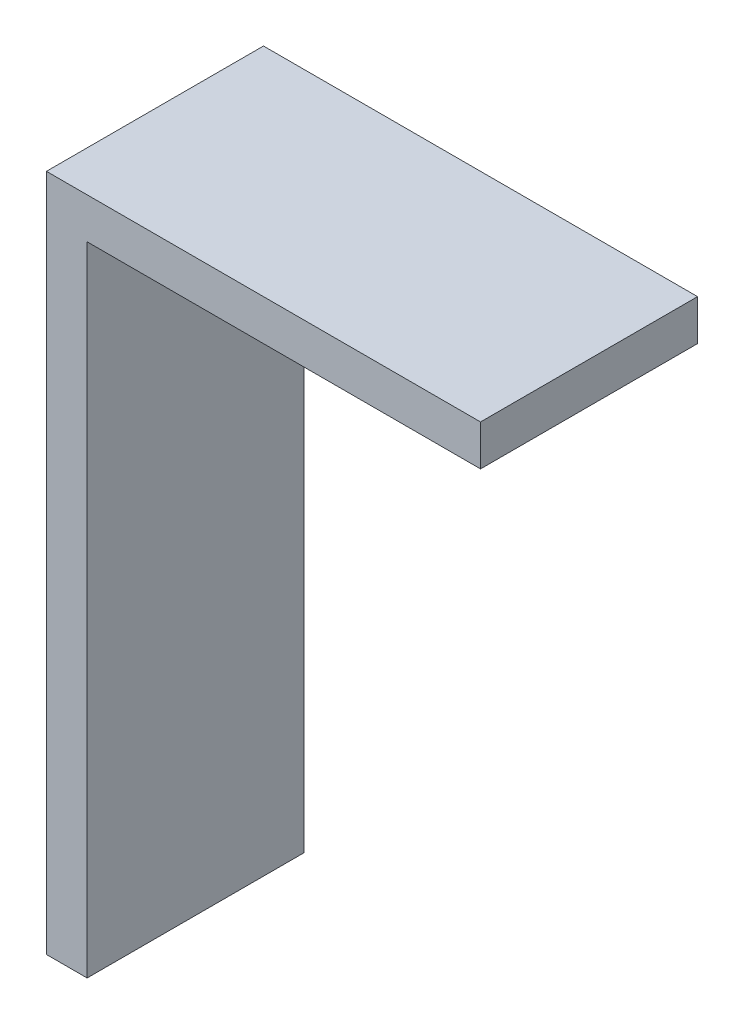
from build123d import *

# Parameters (mm, degrees)
SALIENTE_EXTRUIR1_DEPTH = 160


with BuildPart() as part:
    # Croquis1 → Saliente-Extruir1 (new body)
    with BuildSketch(Plane.XY):
        Polygon((0, 0), (0, 500), (320, 500), (320, 470), (30, 470), (30, 0), align=None)
    extrude(amount=SALIENTE_EXTRUIR1_DEPTH)


solid = part.part
